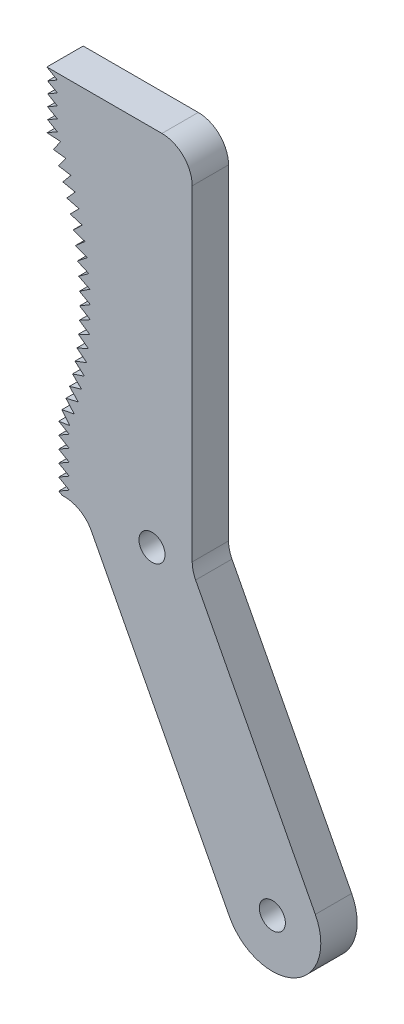
from build123d import *

# Parameters (mm, degrees)
SKETCH1_R           = 2.15
BOSS_EXTRUDE1_DEPTH = 6
CUT_EXTRUDE1_DEPTH  = 65.899922958
LPATTERN1_COUNT     = 5
LPATTERN1_PITCH     = 1.85
FILLET1_R           = 5
CUT_EXTRUDE2_DEPTH  = 65.899922958
CIRPATTERN1_COUNT   = 20
CIRPATTERN1_ANGLE   = 47
CUT_EXTRUDE3_DEPTH  = 65.899922958
LPATTERN2_COUNT     = 8
LPATTERN2_PITCH     = 2


with BuildPart() as part:
    # Sketch1 → Boss-Extrude1 (new body)
    with BuildSketch(Plane.XY):
        with BuildLine():
            Line((0, 60), (0, 0))
            Line((0, 0), (20.330487993, -39.021420502))
            ThreePointArc((20.330487993, -39.021420502), (16.932136627, -49.812676592), (6.140880537, -46.414325226))
            Line((6.140880537, -46.414325226), (-18.041372942, 0))
            Line((-18.041372942, 0), (-22.041372942, 0))
            Line((-22.041372942, 0), (-22.041372942, 11.19846791))
            ThreePointArc((-22.041372942, 11.19846791), (-18.769082447, 31.167731967), (-24, 50.715542423))
            Line((-24, 50.715542423), (-24, 60))
            Line((-24, 60), (0, 60))
        make_face()
        with Locations((-6.63687696, 0)):
            Circle(SKETCH1_R, mode=Mode.SUBTRACT)
        with Locations((13.235684265, -42.717872864)):
            Circle(SKETCH1_R, mode=Mode.SUBTRACT)
    extrude(amount=BOSS_EXTRUDE1_DEPTH)

    # Sketch2 → Cut-Extrude1 (cut, through all)
    with BuildSketch(Plane.XY.offset(6)):
        Polygon((-24, 60), (-22.267949192, 59), (-24, 58), align=None)
    cut_extrude1 = extrude(amount=-CUT_EXTRUDE1_DEPTH, mode=Mode.SUBTRACT)

    # LPattern1: Cut-Extrude1 ×5
    with Locations(*[(0, -i * LPATTERN1_PITCH, 0) for i in range(1, LPATTERN1_COUNT)]):
        add(cut_extrude1, mode=Mode.SUBTRACT)

    # Fillet1
    fillet1_edges = [part.edges().sort_by_distance(p)[0] for p in [
        (0, 60, 3),
        (0, 0, 3),
        (-18.041372942, 0, 3),
    ]]
    fillet(fillet1_edges, radius=FILLET1_R)

    # Sketch3 → Cut-Extrude2 (cut, through all)
    with BuildSketch(Plane.XY.offset(6)):
        Polygon((-23.954411467, 50.626320552), (-21.741449412, 50.459283267), (-22.992588972, 48.626320552), align=None)
    cut_extrude2 = extrude(amount=-CUT_EXTRUDE2_DEPTH, mode=Mode.SUBTRACT)

    # CirPattern1: Cut-Extrude2 ×20 about axis
    cirpattern1_axis = Axis((-66.806944036, 28.78678002, 0), (0, 0, -1))
    for i in range(1, CIRPATTERN1_COUNT):
        add(cut_extrude2.rotate(cirpattern1_axis, i * CIRPATTERN1_ANGLE / (CIRPATTERN1_COUNT - 1)), mode=Mode.SUBTRACT)

    # Sketch4 → Cut-Extrude3 (cut, through all)
    with BuildSketch(Plane.XY.offset(6)):
        Polygon((-22.041372942, 10.33072384), (-20.309322134, 9.33072384), (-22.041372942, 8.33072384), align=None)
    cut_extrude3 = extrude(amount=-CUT_EXTRUDE3_DEPTH, mode=Mode.SUBTRACT)

    # LPattern2: Cut-Extrude3 ×8
    with Locations(*[(0, -i * LPATTERN2_PITCH, 0) for i in range(1, LPATTERN2_COUNT)]):
        add(cut_extrude3, mode=Mode.SUBTRACT)


solid = part.part
